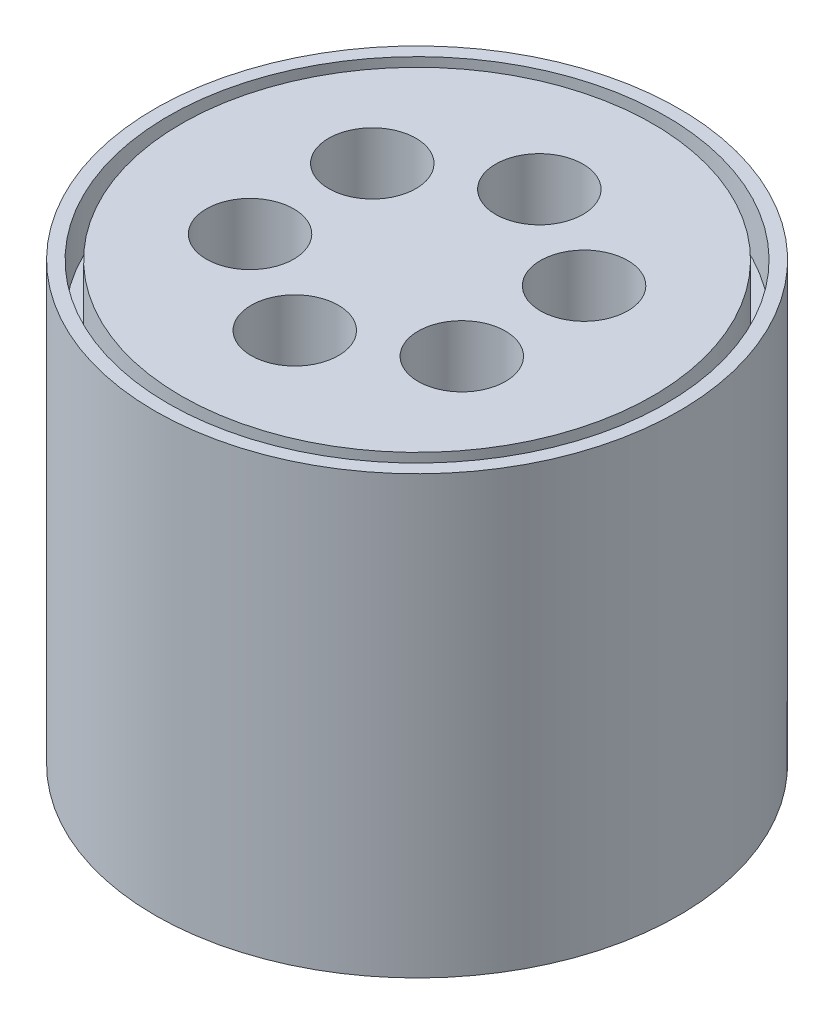
from build123d import *

# Parameters (mm, degrees)
SKETCH1_R           = 15
BOSS_EXTRUDE1_DEPTH = 25
SKETCH4_R           = 14.25
SKETCH4_R_2         = 13.5
CUT_EXTRUDE2_DEPTH  = 3
SKETCH5_R           = 2.5
CUT_EXTRUDE3_DEPTH  = 22
SKETCH6_R           = 2.5
CUT_EXTRUDE4_DEPTH  = 10


with BuildPart() as part:
    # Sketch1 → Boss-Extrude1 (new body)
    with BuildSketch(Plane(origin=(0, 0, 0), x_dir=(1, 0, 0), z_dir=(0, 1, 0))):
        with Locations(Location((0, 0, 0), (0, 0, 270))):
            Circle(SKETCH1_R)
    extrude(amount=BOSS_EXTRUDE1_DEPTH)

    # Sketch4 → Cut-Extrude2 (cut)
    with BuildSketch(Plane(origin=(0, 25, 0), x_dir=(1, 0, 0), z_dir=(0, 1, 0))):
        with Locations(Location((0, 0, 0), (0, 0, 270))):
            Circle(SKETCH4_R)
        with Locations(Location((0, 0, 0), (0, 0, 270))):
            Circle(SKETCH4_R_2, mode=Mode.SUBTRACT)
    extrude(amount=-CUT_EXTRUDE2_DEPTH, mode=Mode.SUBTRACT)

    # Sketch5 → Cut-Extrude3 (cut)
    with BuildSketch(Plane(origin=(0, 25, 0), x_dir=(1, 0, 0), z_dir=(0, 1, 0))):
        with Locations(Location((0, 7, 0), (0, 0, 270))):
            Circle(SKETCH5_R)
        with Locations(Location((6.062177826, 3.5, 0), (0, 0, 270))):
            Circle(SKETCH5_R)
        with Locations(Location((6.062177826, -3.5, 0), (0, 0, 270))):
            Circle(SKETCH5_R)
        with Locations(Location((0, -7, 0), (0, 0, 270))):
            Circle(SKETCH5_R)
        with Locations(Location((-6.062177826, -3.5, 0), (0, 0, 270))):
            Circle(SKETCH5_R)
        with Locations(Location((-6.062177826, 3.5, 0), (0, 0, 270))):
            Circle(SKETCH5_R)
    extrude(amount=-CUT_EXTRUDE3_DEPTH, mode=Mode.SUBTRACT)

    # Sketch6 → Cut-Extrude4 (cut)
    with BuildSketch(Plane.XZ):
        with Locations(Location((0, 0, 0), (0, 0, 270))):
            Circle(SKETCH6_R)
    extrude(amount=-CUT_EXTRUDE4_DEPTH, mode=Mode.SUBTRACT)


solid = part.part
